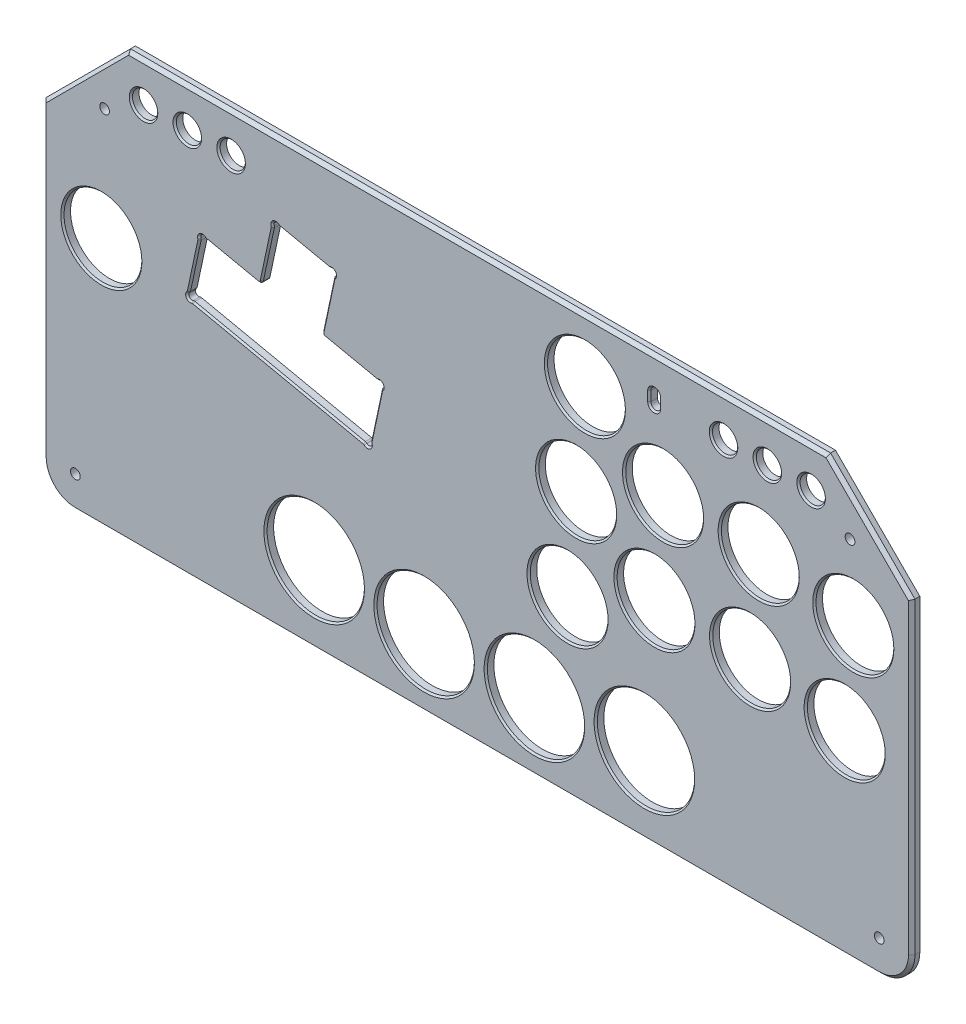
from build123d import *

# Parameters (mm, degrees)
BOSS_EXTRUDE1_DEPTH   = 2.5
SKETCH24_R            = 3.9
CUT_EXTRUDE2_DEPTH    = 307.16304509
SKETCH1_R             = 12
SKETCH1_R_2           = 15
CUT_EXTRUDE3_DEPTH    = 307.16304509
CUT_EXTRUDE5_DEPTH    = 326.800182738
CUT_EXTRUDE6_DEPTH    = 307.16304509
F_3_0MM_DOWEL_HOLE1_D = 3
FILLET1_R             = 1
CHAMFER1_SIZE         = 1
CHAMFER2_SIZE         = 0.5


with BuildPart() as part:
    # Sketch2 → Boss-Extrude1 (new body)
    with BuildSketch(Plane.XY):
        with BuildLine():
            Line((6.41186441, 110.238694526), (6.41186441, 15.286374556))
            ThreePointArc((6.41186441, 15.286374556), (9.340796598, 8.215306744), (16.41186441, 5.286374556))
            Line((16.41186441, 5.286374556), (264.168886442, 5.286374556))
            ThreePointArc((264.168886442, 5.286374556), (271.239954254, 8.215306744), (274.168886442, 15.286374556))
            Line((274.168886442, 15.286374556), (274.168886442, 110.238694526))
            Line((274.168886442, 110.238694526), (248.168886442, 136.238694526))
            Line((248.168886442, 136.238694526), (32.41186441, 136.238694526))
            Line((32.41186441, 136.238694526), (6.41186441, 110.238694526))
        make_face()
    extrude(amount=-BOSS_EXTRUDE1_DEPTH)

    # Sketch24 → Cut-Extrude2 (cut, through all)
    with BuildSketch(Plane.XY):
        with Locations((37.41186441, 124.238694526)):
            Circle(SKETCH24_R)
        with Locations((50.91186441, 124.238694526)):
            Circle(SKETCH24_R)
        with Locations((64.41186441, 124.238694526)):
            Circle(SKETCH24_R)
        with Locations((216.168886442, 124.238694526)):
            Circle(SKETCH24_R)
        with Locations((229.668886442, 124.238694526)):
            Circle(SKETCH24_R)
        with Locations((243.168886442, 124.238694526)):
            Circle(SKETCH24_R)
        with BuildLine():
            Line((193.298949614, 125.738694526), (193.298949614, 122.738694526))
            ThreePointArc((193.298949614, 122.738694526), (194.798949614, 121.238694526), (196.298949614, 122.738694526))
            Line((196.298949614, 122.738694526), (196.298949614, 125.738694526))
            ThreePointArc((196.298949614, 125.738694526), (194.798949614, 127.238694526), (193.298949614, 125.738694526))
        make_face()
    extrude(amount=-CUT_EXTRUDE2_DEPTH, mode=Mode.SUBTRACT)

    # Sketch1 → Cut-Extrude3 (cut, through all)
    with BuildSketch(Plane.XY):
        with Locations((24.41186441, 82.179064133)):
            Circle(SKETCH1_R)
        with Locations((168.091946024, 58.360067852)):
            Circle(SKETCH1_R)
        with Locations((194.873540874, 70.729230202)):
            Circle(SKETCH1_R)
        with Locations((224.358659158, 69.792320505)):
            Circle(SKETCH1_R)
        with Locations((253.510608286, 65.274150291)):
            Circle(SKETCH1_R)
        with Locations((256.168886442, 94.654135948)):
            Circle(SKETCH1_R)
        with Locations((227.016937315, 99.172306162)):
            Circle(SKETCH1_R)
        with Locations((197.531819031, 100.10921586)):
            Circle(SKETCH1_R)
        with Locations((170.75022418, 87.740053509)):
            Circle(SKETCH1_R)
        with Locations((191.774681199, 29.091460603)):
            Circle(SKETCH1_R_2)
        with Locations((157.891946024, 26.270067852)):
            Circle(SKETCH1_R_2)
        with Locations((123.891946024, 26.270067852)):
            Circle(SKETCH1_R_2)
        with Locations((90.009210849, 29.091460603)):
            Circle(SKETCH1_R_2)
        with Locations((173.429012786, 117.118176179)):
            Circle(SKETCH1_R)
    extrude(amount=-CUT_EXTRUDE3_DEPTH, mode=Mode.SUBTRACT)

    # Sketch4 → Cut-Extrude5 (cut, through all)
    with BuildSketch(Plane(origin=(-30.20834345, 20.07496957, 0), x_dir=(0.9781476007338056, -0.2079116908177598, 0), z_dir=(0, 0, 1))):
        Polygon((86.170570415, 113.241725336), (86.170570415, 94.191725336), (67.120570415, 94.191725336), (67.120570415, 75.141725336), (124.270570415, 75.141725336), (124.270570415, 94.191725336), (105.220570415, 94.191725336), (105.220570415, 113.241725336), align=None)
    extrude(amount=-CUT_EXTRUDE5_DEPTH, mode=Mode.SUBTRACT)

    # Sketch27 → Cut-Extrude6 (cut, through all)
    with BuildSketch(Plane.XY):
        with BuildLine():
            Line((54.735010804, 96.86991883), (56.41235194, 97.9591969))
            ThreePointArc((56.41235194, 97.9591969), (55.029042337, 98.253228433), (54.735010804, 96.86991883))
        make_face()
        with BuildLine():
            Line((51.36235616, 81.002826242), (52.45163423, 79.325485106))
            ThreePointArc((52.45163423, 79.325485106), (51.068324627, 79.619516639), (51.36235616, 81.002826242))
        make_face()
        with BuildLine():
            Line((105.586150406, 68.031395041), (107.263491542, 69.120673111))
            ThreePointArc((107.263491542, 69.120673111), (106.969460009, 67.737363508), (105.586150406, 68.031395041))
        make_face()
        with BuildLine():
            Line((109.546868116, 86.665106835), (110.636146186, 84.987765699))
            ThreePointArc((110.636146186, 84.987765699), (110.930177719, 86.371075302), (109.546868116, 86.665106835))
        make_face()
        with BuildLine():
            Line((77.329440308, 111.542912914), (79.006781444, 112.632190984))
            ThreePointArc((79.006781444, 112.632190984), (77.623471841, 112.926222516), (77.329440308, 111.542912914))
        make_face()
        with BuildLine():
            Line((94.873874032, 109.259536339), (95.963152102, 107.582195203))
            ThreePointArc((95.963152102, 107.582195203), (96.257183635, 108.965504806), (94.873874032, 109.259536339))
        make_face()
    extrude(amount=-CUT_EXTRUDE6_DEPTH, mode=Mode.SUBTRACT)

    # Ø3.0mm Dowel Hole1 (through all)
    with Locations(Plane.XY):
        with Locations((25.42227205, 117.228286886), (16.41186441, 15.286374556), (264.168886442, 15.286374556), (255.158478802, 117.228286886)):
            Hole(F_3_0MM_DOWEL_HOLE1_D / 2)

    # Fillet1
    fillet1_edges = [part.edges().sort_by_distance(p)[0] for p in [
        (105.586150406, 68.031395041, -1.25),
        (107.263491542, 69.120673111, -1.25),
        (110.636146186, 84.987765699, -1.25),
        (109.546868116, 86.665106835, -1.25),
        (92.296465925, 90.331793012, -1.25),
        (95.963152102, 107.582195203, -1.25),
        (94.873874032, 109.259536339, -1.25),
        (77.329440308, 111.542912914, -1.25),
        (79.006781444, 112.632190984, -1.25),
        (73.662754131, 94.292510723, -1.25),
        (52.45163423, 79.325485106, -1.25),
        (51.36235616, 81.002826242, -1.25),
        (54.735010804, 96.86991883, -1.25),
        (56.41235194, 97.9591969, -1.25),
    ]]
    fillet(fillet1_edges, radius=FILLET1_R)

    # Chamfer1
    chamfer1_edges = [part.edges().sort_by_distance(p)[0] for p in [
        (274.168886442, 62.762534541, 0),
        (271.239954254, 8.215306744, 0),
        (140.290375426, 5.286374556, 0),
        (9.340796598, 8.215306744, 0),
        (261.168886442, 123.238694526, 0),
        (140.290375426, 136.238694526, 0),
        (6.41186441, 62.762534541, 0),
        (19.41186441, 123.238694526, 0),
    ]]
    chamfer(chamfer1_edges, length=CHAMFER1_SIZE)

    # Chamfer2
    chamfer2_edges = [part.edges().sort_by_distance(p)[0] for p in [
        (239.268886442, 124.238694526, 0),
        (225.768886442, 124.238694526, 0),
        (212.268886442, 124.238694526, 0),
        (193.298949614, 124.238694526, 0),
        (194.798949614, 121.238694526, 0),
        (194.798949614, 127.238694526, 0),
        (196.298949614, 124.238694526, 0),
        (60.51186441, 124.238694526, 0),
        (47.01186441, 124.238694526, 0),
        (33.51186441, 124.238694526, 0),
        (161.429012786, 117.118176179, 0),
        (244.168886442, 94.654135948, 0),
        (215.016937315, 99.172306162, 0),
        (185.531819031, 100.10921586, 0),
        (158.75022418, 87.740053509, 0),
        (182.873540874, 70.729230202, 0),
        (212.358659158, 69.792320505, 0),
        (241.510608286, 65.274150291, 0),
        (176.774681199, 29.091460603, 0),
        (156.091946024, 58.360067852, 0),
        (142.891946024, 26.270067852, 0),
        (108.891946024, 26.270067852, 0),
        (75.009210849, 29.091460603, 0),
        (12.41186441, 82.179064133, 0),
        (86.940327738, 110.945863661, 0),
        (79.077438822, 112.655313348, 0),
        (94.818730018, 109.309398615, 0),
        (77.623471841, 112.926222516, 0),
        (96.257183635, 108.965504806, 0),
        (77.279578032, 111.487768899, 0),
        (95.986274466, 107.511537825, 0),
        (75.565237838, 103.242992853, 0),
        (94.198949632, 99.282275143, 0),
        (73.437157256, 94.639899446, 0),
        (92.643854649, 90.557389887, 0),
        (64.712272, 96.19499443, 0),
        (101.246948056, 88.429309305, 0),
        (56.483009318, 97.982319264, 0),
        (109.491724102, 86.714969111, 0),
        (55.029042337, 98.253228433, 0),
        (110.930177719, 86.371075302, 0),
        (54.685148528, 96.814774815, 0),
        (110.65926855, 84.917108321, 0),
        (53.048683482, 88.936372536, 0),
        (108.949818864, 77.054219405, 0),
        (51.339233796, 81.07348362, 0),
        (107.313353817, 69.175817126, 0),
        (51.068324627, 79.619516639, 0),
        (106.969460009, 67.737363508, 0),
        (52.506778244, 79.27562283, 0),
        (105.515493027, 68.008272677, 0),
        (79.018892318, 73.678440073, 0),
    ]]
    chamfer(chamfer2_edges, length=CHAMFER2_SIZE)


solid = part.part
